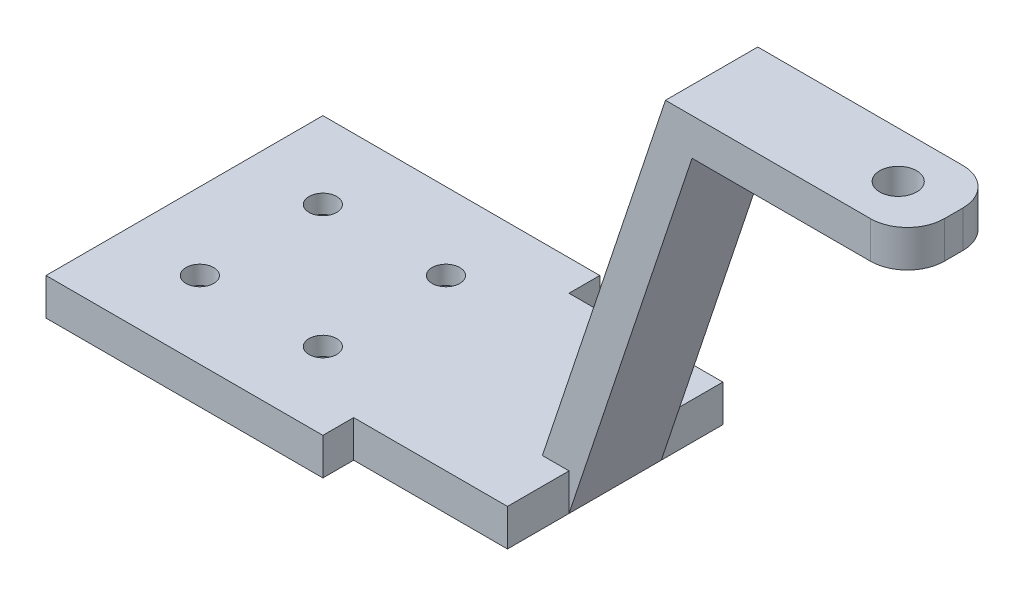
from build123d import *

# Parameters (mm, degrees)
SKETCH1_W                                        = 45
SKETCH1_H                                        = 45
BASE_DEPTH                                       = 6
CBORE_FOR_M4_HEX_HEAD_MACHINE_SCREW1_D           = 4.5
CBORE_FOR_M4_HEX_HEAD_MACHINE_SCREW1_CBORE_D     = 10.59
CBORE_FOR_M4_HEX_HEAD_MACHINE_SCREW1_CBORE_DEPTH = 3
SKETCH4_W                                        = 35
SKETCH4_H                                        = 6
STANDING_PLATFORM_DEPTH                          = 25
FRONT_ARM_DEPTH                                  = 7.5
SKETCH6_R                                        = 3
STEERING_HOLE_DEPTH                              = 15
FILLET1_R                                        = 6


with BuildPart() as part:
    # Sketch1 → BASE (new body)
    with BuildSketch(Plane(origin=(0, 0, 0), x_dir=(1, 0, 0), z_dir=(0, 1, 0))):
        Rectangle(SKETCH1_W, SKETCH1_H)
    extrude(amount=-BASE_DEPTH)

    # CBORE for M4 Hex Head Machine Screw1 (through all)
    with Locations(Plane(origin=(0, -6, 0), x_dir=(-1, 0, 0), z_dir=(0, -1, 0))):
        with Locations((10, -10), (-10, -10), (-10, 10), (10, 10)):
            CounterBoreHole(CBORE_FOR_M4_HEX_HEAD_MACHINE_SCREW1_D / 2, CBORE_FOR_M4_HEX_HEAD_MACHINE_SCREW1_CBORE_D / 2, CBORE_FOR_M4_HEX_HEAD_MACHINE_SCREW1_CBORE_DEPTH)

    # Sketch4 → Standing Platform (add)
    with BuildSketch(Plane(origin=(22.5, 0, 0), x_dir=(0, 0, -1), z_dir=(1, 0, 0))):
        with Locations((0, -3)):
            Rectangle(SKETCH4_W, SKETCH4_H)
    extrude(amount=STANDING_PLATFORM_DEPTH)

    # Sketch5 → Front Arm (add, symmetric)
    with BuildSketch(Plane.XY):
        Polygon((47.5, -6), (67.5, 54), (102.5, 54), (102.5, 60), (63.17544468, 60), (41.17544468, -6), align=None)
    extrude(amount=FRONT_ARM_DEPTH, both=True)

    # Sketch6 → Steering Hole (cut)
    with BuildSketch(Plane(origin=(0, 60, 0), x_dir=(1, 0, 0), z_dir=(0, 1, 0))):
        with Locations(Location((93.5, 0, 0), (0, 0, 270))):
            Circle(SKETCH6_R)
    extrude(amount=-STEERING_HOLE_DEPTH, mode=Mode.SUBTRACT)

    # Fillet1
    fillet1_edges = [part.edges().sort_by_distance(p)[0] for p in [
        (102.5, 57, 7.5),
        (102.5, 57, -7.5),
    ]]
    fillet(fillet1_edges, radius=FILLET1_R)


solid = part.part
